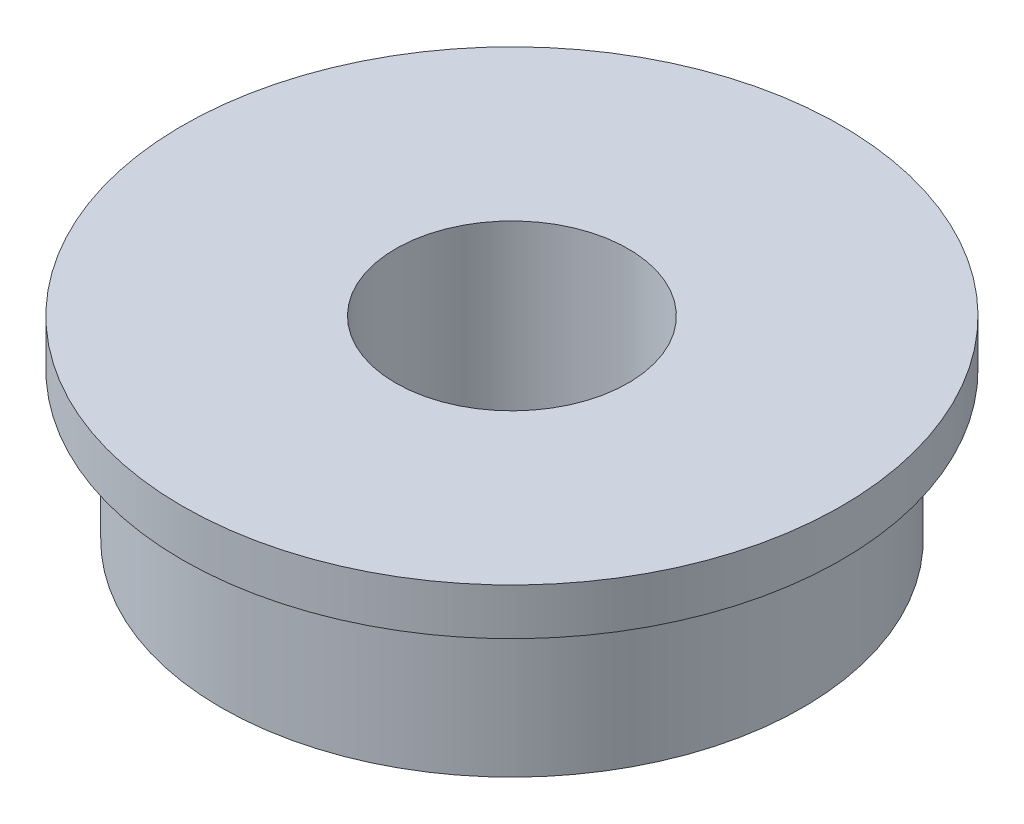
from build123d import *


with BuildPart() as part:
    # 草图1 → 旋转1 (revolve)
    with BuildSketch(Plane.XY, mode=Mode.PRIVATE) as revolve_1_sk:
        Polygon((3, 0), (7.5, 0), (7.5, 3.8), (8.5, 3.8), (8.5, 5), (3, 5), align=None)
    revolve(revolve_1_sk.sketch.rotate(Axis((0, 3.811884808, 0), (0, -1, 0)), 90), axis=Axis((0, 3.811884808, 0), (0, -1, 0)))


solid = part.part
